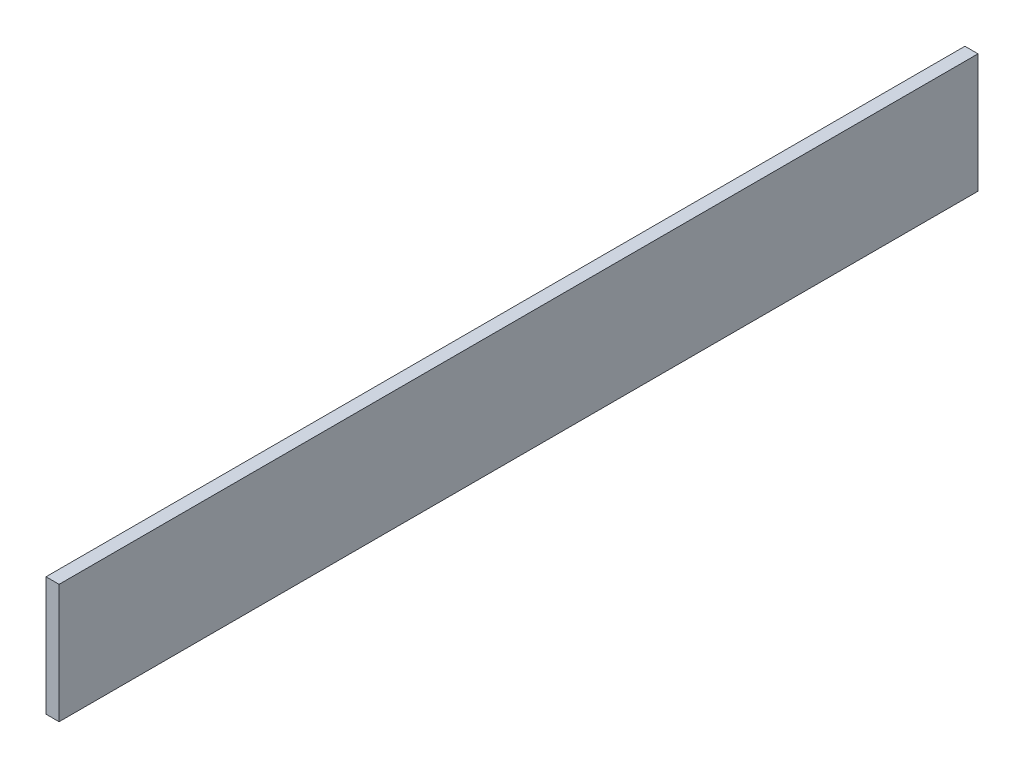
from build123d import *

# Parameters (mm, degrees)
SKETCH1_W        = 200
SKETCH1_H        = 1544
EXTRUSION1_DEPTH = 22


with BuildPart() as part:
    # Sketch1 → Extrusion1 (new body)
    with BuildSketch(Plane.YZ):
        Rectangle(SKETCH1_W, SKETCH1_H)
    extrude(amount=EXTRUSION1_DEPTH)


solid = part.part
